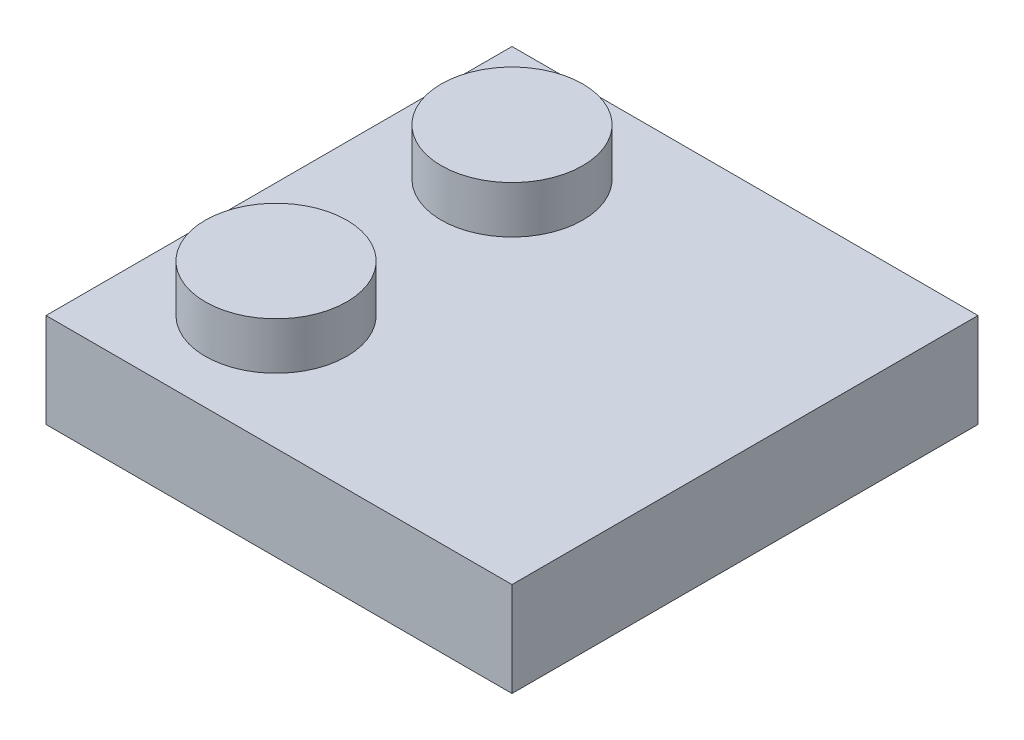
from build123d import *

# Parameters (mm, degrees)
MAINBASESKETCH_W          = 15.8
MAINBASESKETCH_H          = 3.2
MAINBASEEXTRUDE_DEPTH     = 7.9
STUDSSKETCH_R             = 2.4
STUDSEXTRUDE_DEPTH        = 1.6
STUDSPATTERN_COUNT        = 2
STUDSPATTERN_PITCH        = 8
MAINBASESHELL_T           = -1.2
UNDERSIDECIRCLEEXT_START  = -0.2
UNDERSIDECIRCLESKETCH_R   = 3.15
UNDERSIDECIRCLESKETCH_R_2 = 2.4
UNDERSIDECIRCLEEXT_DEPTH  = 1.6


with BuildPart() as part:
    # MainBaseSketch → MainBaseExtrude (new, symmetric)
    with BuildSketch(Plane.XY):
        with Locations((8.581967213, 1.6)):
            Rectangle(MAINBASESKETCH_W, MAINBASESKETCH_H)
    extrude(amount=MAINBASEEXTRUDE_DEPTH, both=True)

    # StudsSketch → StudsExtrude (add)
    with BuildSketch(Plane(origin=(0, 3.2, 0), x_dir=(1, 0, 0), z_dir=(0, 1, 0))):
        with Locations((4.581967213, 4)):
            Circle(STUDSSKETCH_R)
    studsextrude = extrude(amount=STUDSEXTRUDE_DEPTH)

    # StudsPattern: StudsExtrude ×2
    with Locations(*[(0, 0, i * STUDSPATTERN_PITCH) for i in range(1, STUDSPATTERN_COUNT)]):
        add(studsextrude)

    # MainBaseShell
    mainbaseshell_openings = [part.faces().sort_by_distance(p)[0] for p in [
        (8.581967213, 0, 0),
    ]]
    offset(amount=MAINBASESHELL_T, openings=mainbaseshell_openings, kind=Kind.INTERSECTION)

    # UnderSideCircleSketch → UnderSideCircleExt (add)
    with BuildSketch(Plane.XZ.offset(-2).offset(UNDERSIDECIRCLEEXT_START)):
        with Locations((8.581967213, 0)):
            Circle(UNDERSIDECIRCLESKETCH_R)
        with Locations((8.581967213, 0)):
            Circle(UNDERSIDECIRCLESKETCH_R_2, mode=Mode.SUBTRACT)
    extrude(amount=UNDERSIDECIRCLEEXT_DEPTH)


solid = part.part
